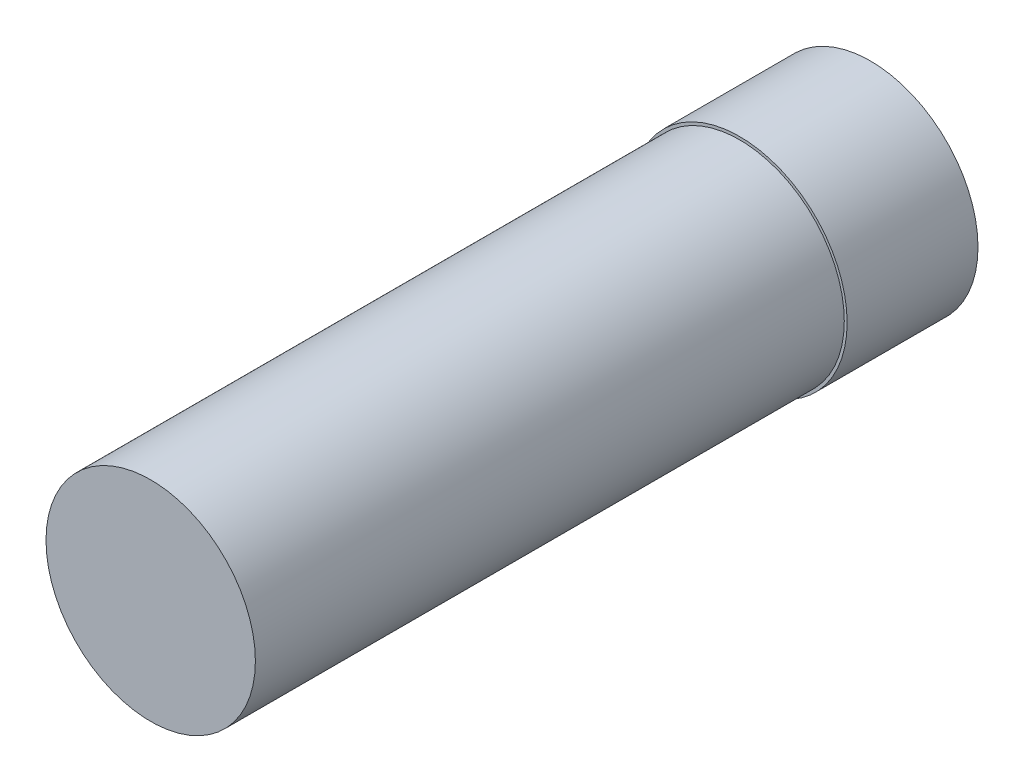
from build123d import *

# Parameters (mm, degrees)
SKETCH_1_R      = 2.465
EXTRUDE_1_DEPTH = 3
SKETCH_2_R      = 2.4
EXTRUDE_2_DEPTH = 13.5


with BuildPart() as part:
    # 스케치1 → 보스-돌출1 (new body)
    with BuildSketch(Plane.XY):
        Circle(SKETCH_1_R)
    extrude(amount=EXTRUDE_1_DEPTH)

    # 스케치2 → 보스-돌출2 (add)
    with BuildSketch(Plane.XY.offset(3)):
        Circle(SKETCH_2_R)
    extrude(amount=EXTRUDE_2_DEPTH)


solid = part.part
